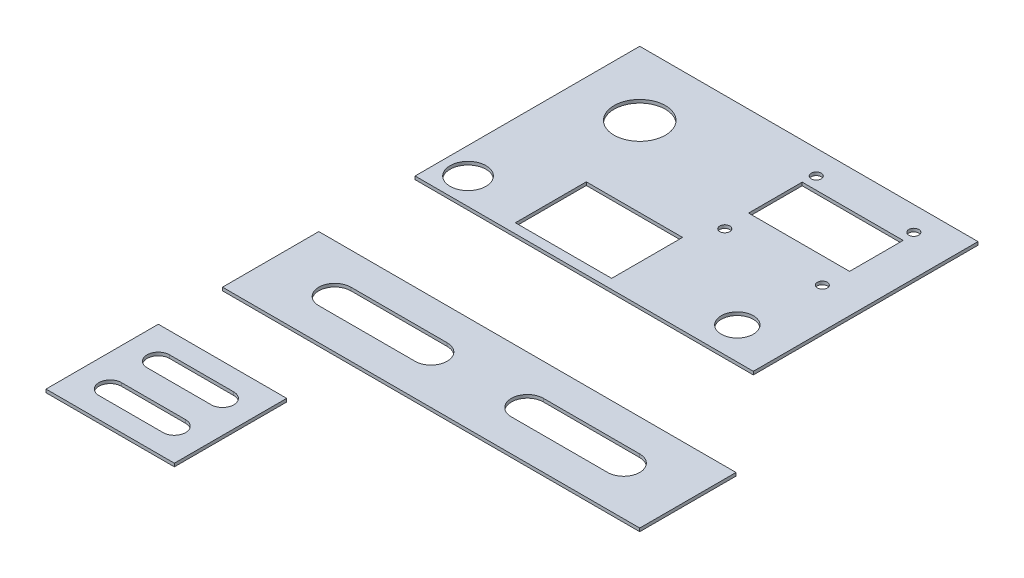
from build123d import *

# Parameters (mm, degrees)
SKETCH1_W           = 105.4
SKETCH1_H           = 70
SKETCH1_R           = 5.59
SKETCH1_R_2         = 8
SKETCH1_R_3         = 5
SKETCH1_R_4         = 1.55
SKETCH1_W_2         = 31.46
SKETCH1_H_2         = 16.7
SKETCH1_W_3         = 30
SKETCH1_H_3         = 22.1
BOSS_EXTRUDE1_DEPTH = 1
SKETCH2_W           = 130
SKETCH2_H           = 30
BOSS_EXTRUDE2_DEPTH = 1
SKETCH3_W           = 40
SKETCH3_H           = 35
BOSS_EXTRUDE3_DEPTH = 1


with BuildPart() as part:
    # Sketch1 → Boss-Extrude1 (new body)
    with BuildSketch(Plane(origin=(0, 0, 0), x_dir=(1, 0, 0), z_dir=(0, 1, 0))):
        with Locations((52.7, 35)):
            Rectangle(SKETCH1_W, SKETCH1_H)
        with Locations(Location((8.25, 8.25, 0), (0, 0, 270))):
            Circle(SKETCH1_R, mode=Mode.SUBTRACT)
        with Locations(Location((20, 50, 0), (0, 0, 270))):
            Circle(SKETCH1_R_2, mode=Mode.SUBTRACT)
        with Locations(Location((90.4, 10, 0), (0, 0, 270))):
            Circle(SKETCH1_R_3, mode=Mode.SUBTRACT)
        with Locations(Location((62.5, 62.5, 0), (0, 0, 270))):
            Circle(SKETCH1_R_4, mode=Mode.SUBTRACT)
        with Locations(Location((92.9, 62.5, 0), (0, 0, 90))):
            Circle(SKETCH1_R_4, mode=Mode.SUBTRACT)
        with Locations(Location((92.9, 34, 0), (0, 0, 270))):
            Circle(SKETCH1_R_4, mode=Mode.SUBTRACT)
        with Locations(Location((62.5, 34, 0), (0, 0, 90))):
            Circle(SKETCH1_R_4, mode=Mode.SUBTRACT)
        with Locations((77.7, 50.3)):
            Rectangle(SKETCH1_W_2, SKETCH1_H_2, mode=Mode.SUBTRACT)
        with Locations((43.25, 14.05)):
            Rectangle(SKETCH1_W_3, SKETCH1_H_3, mode=Mode.SUBTRACT)
    extrude(amount=BOSS_EXTRUDE1_DEPTH)


with BuildPart() as body_2:
    # Sketch2 → Boss-Extrude2 (new body)
    with BuildSketch(Plane(origin=(0, 0, 0), x_dir=(1, 0, 0), z_dir=(0, 1, 0))):
        with Locations((65, -45)):
            Rectangle(SKETCH2_W, SKETCH2_H)
        with BuildLine():
            Line((20, -40), (50, -40))
            ThreePointArc((50, -40), (55, -45), (50, -50))
            Line((50, -50), (20, -50))
            ThreePointArc((20, -50), (15, -45), (20, -40))
        make_face(mode=Mode.SUBTRACT)
        with BuildLine():
            Line((80, -40), (110, -40))
            ThreePointArc((110, -40), (115, -45), (110, -50))
            Line((110, -50), (80, -50))
            ThreePointArc((80, -50), (75, -45), (80, -40))
        make_face(mode=Mode.SUBTRACT)
    extrude(amount=BOSS_EXTRUDE2_DEPTH)


with BuildPart() as body_3:
    # Sketch3 → Boss-Extrude3 (new body)
    with BuildSketch(Plane(origin=(0, 0, 0), x_dir=(1, 0, 0), z_dir=(0, 1, 0))):
        with Locations((20, -97.5)):
            Rectangle(SKETCH3_W, SKETCH3_H)
        with BuildLine():
            Line((10, -86.5), (30, -86.5))
            ThreePointArc((30, -86.5), (33.5, -90), (30, -93.5))
            Line((30, -93.5), (10, -93.5))
            ThreePointArc((10, -93.5), (6.5, -90), (10, -86.5))
        make_face(mode=Mode.SUBTRACT)
        with BuildLine():
            Line((10, -101.5), (30, -101.5))
            ThreePointArc((30, -101.5), (33.5, -105), (30, -108.5))
            Line((30, -108.5), (10, -108.5))
            ThreePointArc((10, -108.5), (6.5, -105), (10, -101.5))
        make_face(mode=Mode.SUBTRACT)
    extrude(amount=BOSS_EXTRUDE3_DEPTH)


solid = Compound([part.part, body_2.part, body_3.part])
